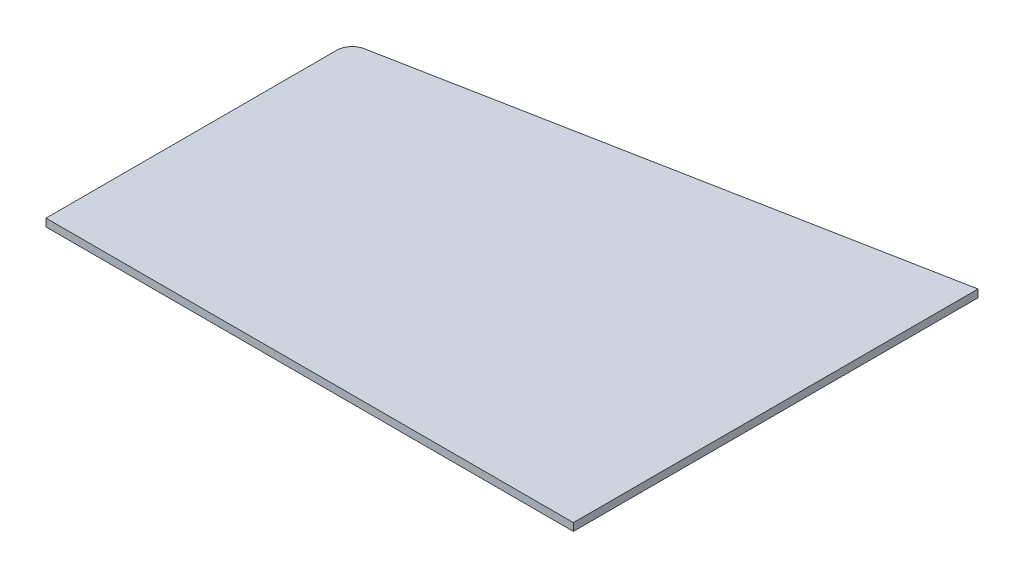
from build123d import *

# Parameters (mm, degrees)
BOSS_EXTRUDE1_DEPTH = 6.35


with BuildPart() as part:
    # Sketch1 → Boss-Extrude1 (new body)
    with BuildSketch(Plane(origin=(0, 0, 0), x_dir=(1, 0, 0), z_dir=(0, 1, 0))):
        with BuildLine():
            Line((0, 0), (437.02224, 0))
            Line((437.02224, 0), (437.02224, 335.28))
            Line((437.02224, 335.28), (10.307768658, 253.437009611))
            ThreePointArc((10.307768658, 253.437009611), (2.910430601, 249.054735438), (0, 240.964350344))
            Line((0, 240.964350344), (0, 0))
        make_face()
    extrude(amount=BOSS_EXTRUDE1_DEPTH)


solid = part.part
